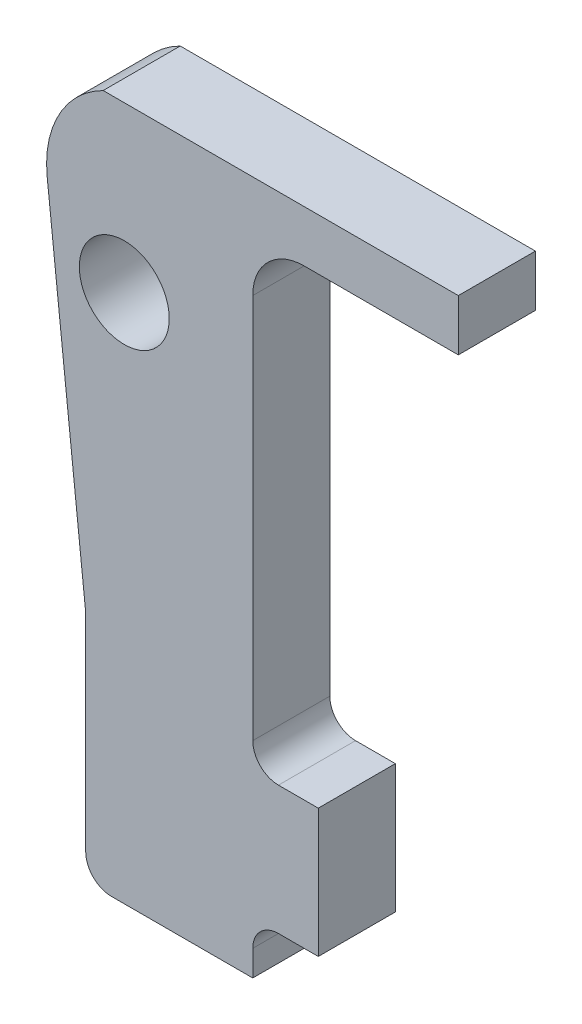
from build123d import *

# Parameters (mm, degrees)
ESQUISSE1_R        = 1.75
BOSS_EXTRU_1_DEPTH = 3


with BuildPart() as part:
    # Esquisse1 → Boss.-Extru.1 (new body)
    with BuildSketch(Plane.XY):
        with BuildLine():
            Line((3.177327772, 17), (17, 17))
            Line((17, 17), (17, 15))
            Line((17, 15), (11, 15))
            ThreePointArc((11, 15), (9.585786438, 14.414213562), (9, 13))
            Line((9, 13), (9, -2))
            ThreePointArc((9, -2), (9.292893219, -2.707106781), (10, -3))
            Line((10, -3), (11.55, -3))
            Line((11.55, -3), (11.55, -8))
            Line((11.55, -8), (10, -8))
            ThreePointArc((10, -8), (9.292893219, -8.292893219), (9, -9))
            Line((9, -9), (9, -10))
            Line((9, -10), (3.5, -10))
            ThreePointArc((3.5, -10), (2.792893219, -9.707106781), (2.5, -9))
            Line((2.5, -9), (2.5, -1))
            ThreePointArc((2.5, -1), (2.498565392, -0.946454153), (2.494265684, -0.89306194))
            Line((2.494265684, -0.89306194), (1, 13))
            ThreePointArc((1, 13), (1.463823787, 15.340120425), (3.177327772, 17))
        make_face()
        with Locations((4, 10.6)):
            Circle(ESQUISSE1_R, mode=Mode.SUBTRACT)
    extrude(amount=BOSS_EXTRU_1_DEPTH)


solid = part.part
